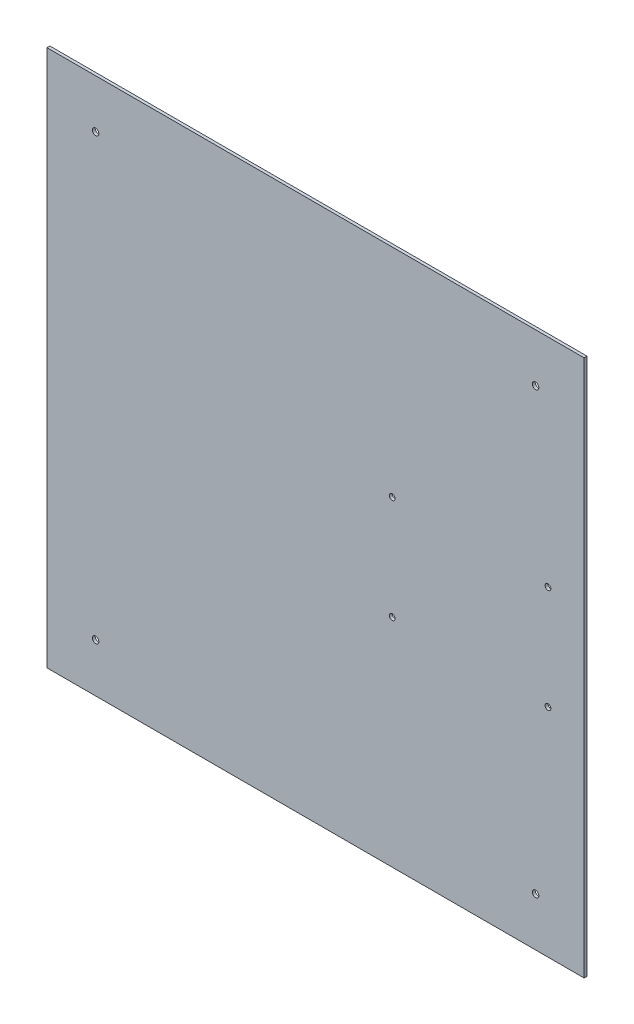
from build123d import *

# Parameters (mm, degrees)
SKETCH1_W           = 370
SKETCH1_H           = 370
SKETCH1_R           = 2.25
SKETCH1_W_2         = 120
SKETCH1_H_2         = 80
SKETCH1_R_2         = 2
BOSS_EXTRUDE2_DEPTH = 2


with BuildPart() as part:
    # Sketch1 → Boss-Extrude2 (new body)
    # profile 1 of 2: a face of its own
    with BuildSketch(Plane.XY):
        Rectangle(SKETCH1_W, SKETCH1_H)
        with Locations((-151.53617158, -151.53617158)):
            Circle(SKETCH1_R, mode=Mode.SUBTRACT)
        with Locations((151.53617158, -151.53617158)):
            Circle(SKETCH1_R, mode=Mode.SUBTRACT)
        with Locations((151.53617158, 151.53617158)):
            Circle(SKETCH1_R, mode=Mode.SUBTRACT)
        with Locations((-151.53617158, 151.53617158)):
            Circle(SKETCH1_R, mode=Mode.SUBTRACT)
        with Locations((106.442762352, 0)):
            Rectangle(SKETCH1_W_2, SKETCH1_H_2, mode=Mode.SUBTRACT)
    # profile 2 of 2: a face of its own
    with BuildSketch(Plane.XY):
        with Locations((106.442762352, 0)):
            Rectangle(SKETCH1_W_2, SKETCH1_H_2)
        with Locations((160.105262352, -35.775)):
            Circle(SKETCH1_R_2, mode=Mode.SUBTRACT)
        with Locations((160.105262352, 35.775)):
            Circle(SKETCH1_R_2, mode=Mode.SUBTRACT)
        with Locations((52.780262352, -35.775)):
            Circle(SKETCH1_R_2, mode=Mode.SUBTRACT)
        with Locations((52.777109457, 35.777101931)):
            Circle(SKETCH1_R_2, mode=Mode.SUBTRACT)
    extrude(amount=BOSS_EXTRUDE2_DEPTH)


solid = part.part
